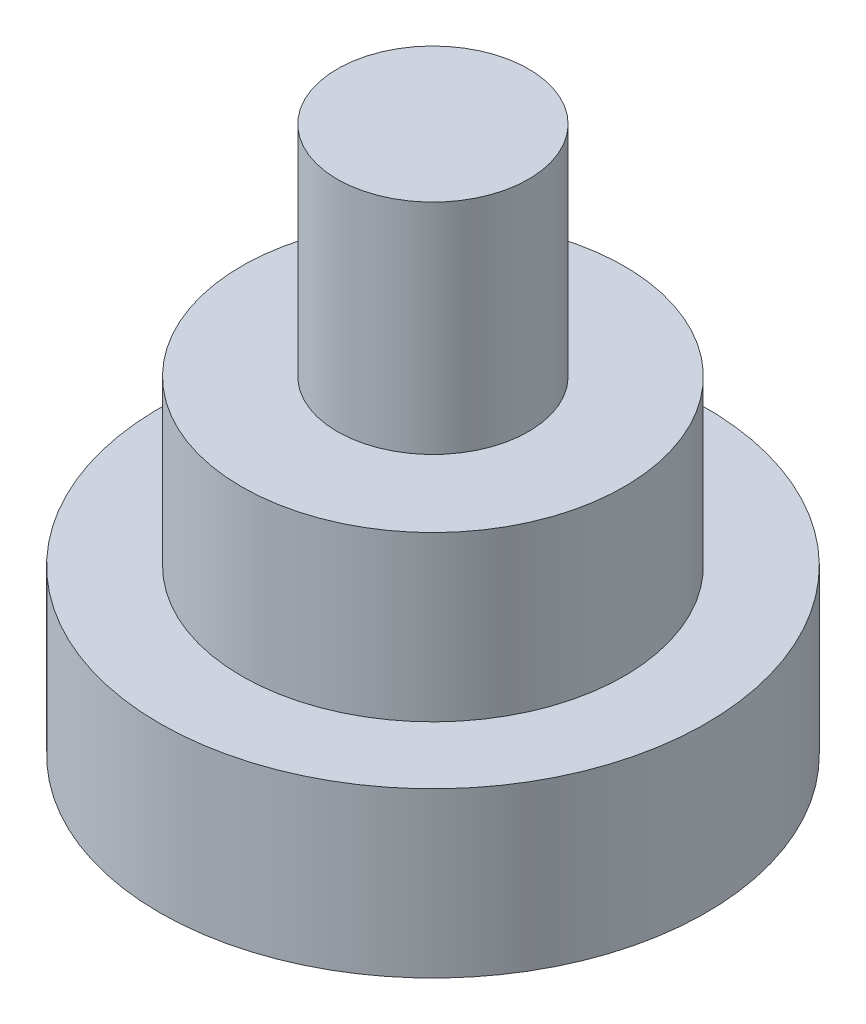
from build123d import *

# Parameters (mm, degrees)
SKETCH2_R           = 5
BOSS_EXTRUDE1_DEPTH = 3
SKETCH3_R           = 3.5
BOSS_EXTRUDE2_DEPTH = 3
SKETCH4_R           = 1.75
BOSS_EXTRUDE3_DEPTH = 4
SKETCH6_R           = 4
CUT_EXTRUDE1_DEPTH  = 1.5


with BuildPart() as part:
    # Sketch2 → Boss-Extrude1 (new body)
    with BuildSketch(Plane(origin=(0, 0, 0), x_dir=(1, 0, 0), z_dir=(0, 1, 0))):
        with Locations(Location((0, 0, 0), (0, 0, 270))):
            Circle(SKETCH2_R)
    extrude(amount=BOSS_EXTRUDE1_DEPTH)

    # Sketch3 → Boss-Extrude2 (add)
    with BuildSketch(Plane(origin=(0, 3, 0), x_dir=(1, 0, 0), z_dir=(0, 1, 0))):
        with Locations(Location((0, 0, 0), (0, 0, 270))):
            Circle(SKETCH3_R)
    extrude(amount=BOSS_EXTRUDE2_DEPTH)

    # Sketch4 → Boss-Extrude3 (add)
    with BuildSketch(Plane(origin=(0, 6, 0), x_dir=(1, 0, 0), z_dir=(0, 1, 0))):
        with Locations(Location((0, 0, 0), (0, 0, 270))):
            Circle(SKETCH4_R)
    extrude(amount=BOSS_EXTRUDE3_DEPTH)

    # Sketch6 → Cut-Extrude1 (cut)
    with BuildSketch(Plane(origin=(0, 0, 0), x_dir=(-1, 0, 0), z_dir=(0, -1, 0))):
        with Locations(Location((0, 0, 0), (0, 0, 90))):
            Circle(SKETCH6_R)
    extrude(amount=-CUT_EXTRUDE1_DEPTH, mode=Mode.SUBTRACT)


solid = part.part
